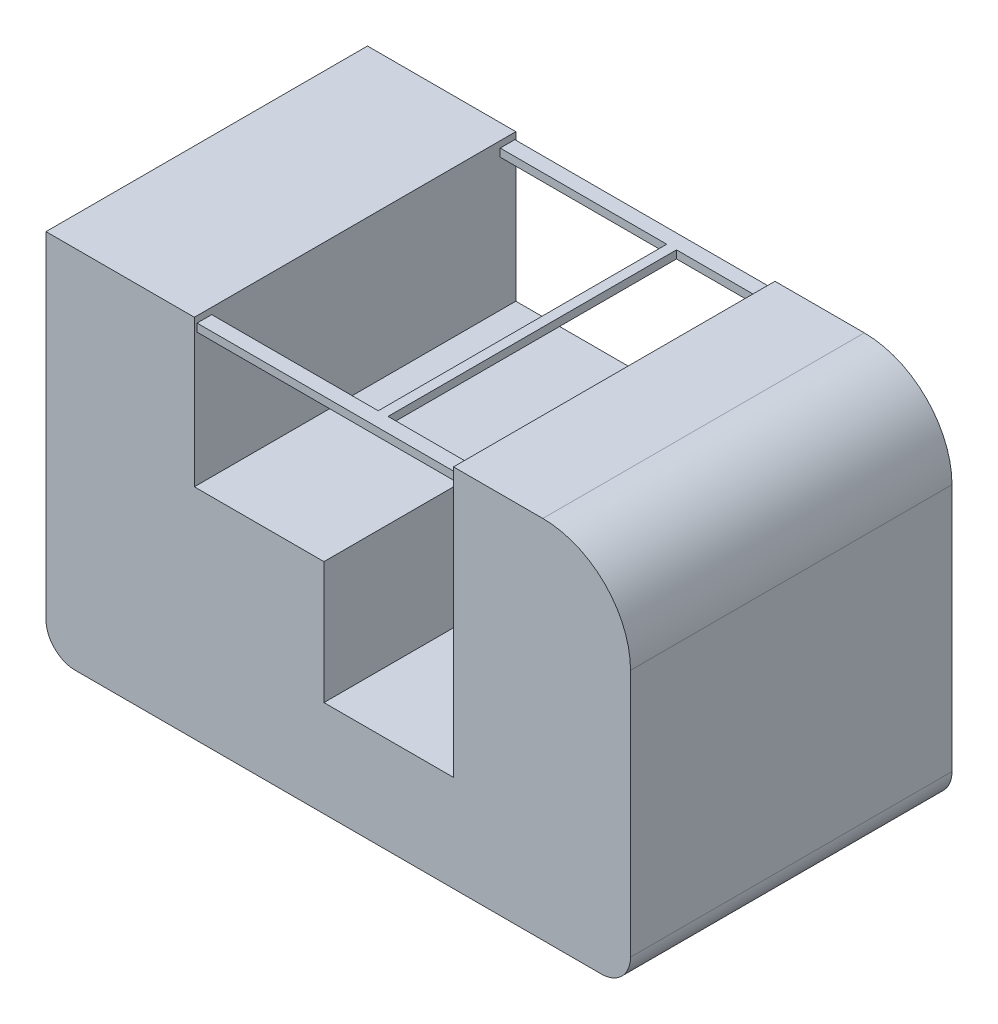
from build123d import *

# Parameters (mm, degrees)
SKETCH2_W           = 50.8
SKETCH2_H           = 31.75
BOSS_EXTRUDE1_DEPTH = 27.94
CUT_EXTRUDE2_DEPTH  = 27.94
FILLET1_R           = 7.62
SKETCH5_W           = 1.27
SKETCH5_H           = 0.685488516
BOSS_EXTRUDE2_DEPTH = 27.94
SKETCH6_W           = 0.849135511
SKETCH6_H           = 0.685488516
BOSS_EXTRUDE3_DEPTH = 25.4
FILLET2_R           = 2.54
FILLET3_R           = 2.54


with BuildPart() as part:
    # Sketch2 → Boss-Extrude1 (new body)
    with BuildSketch(Plane.XY):
        with Locations((25.4, 15.875)):
            Rectangle(SKETCH2_W, SKETCH2_H)
    extrude(amount=BOSS_EXTRUDE1_DEPTH)

    # Sketch3 → Cut-Extrude2 (cut)
    with BuildSketch(Plane.XY.offset(27.94)):
        Polygon((24.154806831, 18.987982921), (24.154806831, 8.376771572), (35.415684182, 8.376771572), (35.415684182, 18.987982921), (35.415684182, 31.75), (12.893929481, 31.75), (12.893929481, 18.987982921), align=None)
    extrude(amount=-CUT_EXTRUDE2_DEPTH, mode=Mode.SUBTRACT)

    # Fillet1
    fillet1_edges = [part.edges().sort_by_distance(p)[0] for p in [
        (50.8, 31.75, 13.97),
    ]]
    fillet(fillet1_edges, radius=FILLET1_R)

    # Sketch5 → Boss-Extrude2 (add)
    with BuildSketch(Plane.ZY.offset(-35.415684182)):
        with Locations((0.724212181, 30.851974388)):
            Rectangle(SKETCH5_W, SKETCH5_H)
        with Locations((27.068073402, 30.851974388)):
            Rectangle(SKETCH5_W, SKETCH5_H)
    extrude(amount=BOSS_EXTRUDE2_DEPTH)

    # Sketch6 → Boss-Extrude3 (add)
    with BuildSketch(Plane.XY.offset(1.359212181)):
        with Locations((27.792387074, 30.851974388)):
            Rectangle(SKETCH6_W, SKETCH6_H)
    extrude(amount=BOSS_EXTRUDE3_DEPTH)

    # Fillet2
    fillet2_edges = [part.edges().sort_by_distance(p)[0] for p in [
        (50.8, 0, 13.97),
    ]]
    fillet(fillet2_edges, radius=FILLET2_R)

    # Fillet3
    fillet3_edges = [part.edges().sort_by_distance(p)[0] for p in [
        (0, 0, 13.97),
    ]]
    fillet(fillet3_edges, radius=FILLET3_R)


solid = part.part
